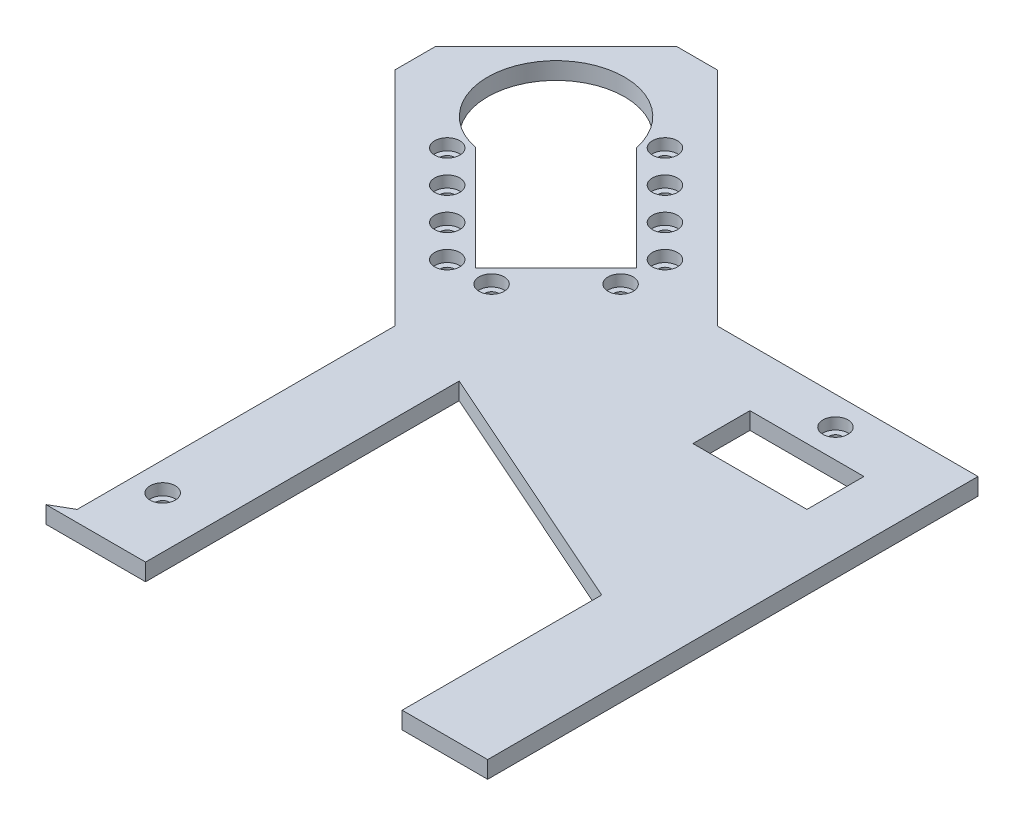
from build123d import *

# Parameters (mm, degrees)
EXTRUDE_1_DEPTH              = 3
CUT_EXTRUDE_1_REACH          = 217.134
HOLE_WIZARD_M2_2_D           = 2.4
HOLE_WIZARD_M2_2_CBORE_D     = 4.4
HOLE_WIZARD_M2_2_CBORE_DEPTH = 2
CUT_EXTRUDE_2_REACH          = 217.134
HOLE_WIZARD_M2_3_D           = 2.4
HOLE_WIZARD_M2_3_CBORE_D     = 4.4
HOLE_WIZARD_M2_3_CBORE_DEPTH = 2
MIRROR_7_COPY_1_REACH        = 217.134
MIRROR_7_COPY_2_D            = 2.4
MIRROR_7_COPY_2_CBORE_D      = 4.4
MIRROR_7_COPY_2_CBORE_DEPTH  = 2
CUT_EXTRUDE_3_REACH          = 217.134
SKETCH_18_W                  = 20
SKETCH_18_H                  = 10
HOLE_WIZARD_M2_4_D           = 2.4
HOLE_WIZARD_M2_4_CBORE_D     = 4.4
HOLE_WIZARD_M2_4_CBORE_DEPTH = 2
HOLE_WIZARD_M2_5_D           = 2.4
HOLE_WIZARD_M2_5_CBORE_D     = 4.4
HOLE_WIZARD_M2_5_CBORE_DEPTH = 2
HOLE_WIZARD_M2_6_D           = 2.4
HOLE_WIZARD_M2_6_CBORE_D     = 4.4
HOLE_WIZARD_M2_6_CBORE_DEPTH = 2
SKETCH_24_W                  = 20
SKETCH_24_H                  = 56
CUT_EXTRUDE_4_DEPTH          = 10
HOLE_WIZARD_M2_7_D           = 2.4
HOLE_WIZARD_M2_7_CBORE_D     = 4.4
HOLE_WIZARD_M2_7_CBORE_DEPTH = 2
SKETCH_26_OUTSIDE_W          = 390.69
SKETCH_26_OUTSIDE_H          = 393.83
SKETCH_26_OUTSIDE_W_2        = 112.890872965
SKETCH_26_OUTSIDE_H_2        = 124.890872965
CUT_EXTRUDE_5_DEPTH          = 10


with BuildPart() as part:
    # 草图1 → 凸台-拉伸1 (new body)
    with BuildSketch(Plane(origin=(0, 0, 0), x_dir=(1, 0, 0), z_dir=(0, 1, 0))):
        Polygon((-45.715728753, 114), (45.715728753, 114), (84.606601718, 152.890872965), (91.67766953, 152.890872965), (112.890872965, 131.67766953), (112.890872965, 124.606601718), (74, 85.715728753), (74, 30), (91.320508076, 20), (146.320508076, 20), (151.320508076, 15), (151.320508076, -15), (146.320508076, -20), (91.320508076, -20), (74, -30), (74, -85.715728753), (112.890872965, -124.606601718), (112.890872965, -131.67766953), (91.67766953, -152.890872965), (84.606601718, -152.890872965), (45.715728753, -114), (-45.715728753, -114), (-84.606601718, -152.890872965), (-91.67766953, -152.890872965), (-112.890872965, -131.67766953), (-112.890872965, -124.606601718), (-74, -85.715728753), (-74, -30), (-91.320508076, -20), (-146.320508076, -20), (-151.320508076, -15), (-151.320508076, 15), (-146.320508076, 20), (-91.320508076, 20), (-74, 30), (-74, 85.715728753), (-112.890872965, 124.606601718), (-112.890872965, 131.67766953), (-91.67766953, 152.890872965), (-84.606601718, 152.890872965), align=None)
    extrude(amount=EXTRUDE_1_DEPTH)

    # 草图2 → 切除-拉伸1 (cut, up to next)
    with BuildSketch(Plane(origin=(0, 3, 0), x_dir=(1, 0, 0), z_dir=(0, 1, 0)), mode=Mode.PRIVATE) as cut_extrude_1_sk1:
        with BuildLine():
            Line((103.820508076, -10), (103.820508076, 10))
            Line((103.820508076, 10), (129.687258495, 10))
            ThreePointArc((129.687258495, 10), (148.320508076, 0), (129.687258495, -10))
            Line((129.687258495, -10), (103.820508076, -10))
        make_face()
    cut_extrude_1_tool1 = extrude(cut_extrude_1_sk1.sketch, amount=-CUT_EXTRUDE_1_REACH, mode=Mode.PRIVATE) & part.part
    cut_extrude_1 = cut_extrude_1_tool1.solids().sort_by_distance((125.74589, 3, 0))[0]
    add(cut_extrude_1, mode=Mode.SUBTRACT)

    # M2 凹头盖螺钉的柱形沉头孔2 (through all)
    with Locations(Plane(origin=(100.320508076, 3, -8), x_dir=(0, 0, 1), z_dir=(0, 1, 0))):
        with Locations((0, 0), (-5.5, 5.25), (-5.5, 13.25), (-5.5, 21.25), (-5.5, 29.25), (16, 0), (21.5, 5.25), (21.5, 13.25), (21.5, 21.25), (21.5, 29.25)):
            hole_wizard_m2_2 = CounterBoreHole(HOLE_WIZARD_M2_2_D / 2, HOLE_WIZARD_M2_2_CBORE_D / 2, HOLE_WIZARD_M2_2_CBORE_DEPTH)

    # 草图10 → 切除-拉伸2 (cut, up to next)
    with BuildSketch(Plane(origin=(0, 3, 0), x_dir=(1, 0, 0), z_dir=(0, 1, 0)), mode=Mode.PRIVATE) as cut_extrude_2_sk1:
        with BuildLine():
            Line((75.767766953, 101.625631329), (61.625631329, 115.767766953))
            Line((61.625631329, 115.767766953), (79.916185958, 134.058321582))
            ThreePointArc((79.916185958, 134.058321582), (100.162950904, 140.162950904), (94.058321582, 119.916185958))
            Line((94.058321582, 119.916185958), (75.767766953, 101.625631329))
        make_face()
    cut_extrude_2_tool1 = extrude(cut_extrude_2_sk1.sketch, amount=-CUT_EXTRUDE_2_REACH, mode=Mode.PRIVATE) & part.part
    cut_extrude_2 = cut_extrude_2_tool1.solids().sort_by_distance((84.200285, 3, -124.200285))[0]
    add(cut_extrude_2, mode=Mode.SUBTRACT)

    # M2 凹头盖螺钉的柱形沉头孔3 (through all)
    with Locations(Plane(origin=(60.388194462, 3, -119.480077554), x_dir=(0, 0, 1), z_dir=(0, 1, 0))):
        with Locations((0, 0), (-5.65685425, 5.65685425), (-11.313708499, 11.313708499), (-16.970562749, 16.970562749), (7.601397898, 0.176776695), (18.915106397, 11.490485194), (19.091883092, 19.091883092), (13.435028842, 24.748737342), (7.778174593, 30.405591591), (2.121320343, 36.062445841)):
            hole_wizard_m2_3 = CounterBoreHole(HOLE_WIZARD_M2_3_D / 2, HOLE_WIZARD_M2_3_CBORE_D / 2, HOLE_WIZARD_M2_3_CBORE_DEPTH)

    # 镜向5: 切除-拉伸1, M2 凹头盖螺钉的柱形沉头孔2 across plane
    add(cut_extrude_1.mirror(Plane(origin=(0, 0, 0), x_dir=(0, 0, 1), z_dir=(1, 0, 0))), mode=Mode.SUBTRACT)
    add(hole_wizard_m2_2.mirror(Plane(origin=(0, 0, 0), x_dir=(0, 0, 1), z_dir=(1, 0, 0))), mode=Mode.SUBTRACT)

    # 镜向6: 切除-拉伸2, M2 凹头盖螺钉的柱形沉头孔3 across plane
    add(cut_extrude_2.mirror(Plane(origin=(0, 0, 0), x_dir=(0, 0, 1), z_dir=(1, 0, 0))), mode=Mode.SUBTRACT)
    add(hole_wizard_m2_3.mirror(Plane(origin=(0, 0, 0), x_dir=(0, 0, 1), z_dir=(1, 0, 0))), mode=Mode.SUBTRACT)

    # 镜向7: 切除-拉伸2, M2 凹头盖螺钉的柱形沉头孔3 across plane
    add(cut_extrude_2.mirror(Plane.XY), mode=Mode.SUBTRACT)
    add(hole_wizard_m2_3.mirror(Plane.XY), mode=Mode.SUBTRACT)

    # 镜向7 copy 1 sketch → 镜向7 copy 1 (cut, up to next)
    with BuildSketch(Plane(origin=(0, 3, 0), x_dir=(-1, 0, 0), z_dir=(0, 1, 0)), mode=Mode.PRIVATE) as mirror_7_copy_1_sk1:
        with BuildLine():
            Line((75.767766953, 101.625631329), (61.625631329, 115.767766953))
            Line((61.625631329, 115.767766953), (79.916185958, 134.058321582))
            ThreePointArc((79.916185958, 134.058321582), (100.162950904, 140.162950904), (94.058321582, 119.916185958))
            Line((94.058321582, 119.916185958), (75.767766953, 101.625631329))
        make_face()
    mirror_7_copy_1_tool1 = extrude(mirror_7_copy_1_sk1.sketch, amount=-MIRROR_7_COPY_1_REACH, mode=Mode.PRIVATE) & part.part
    add(mirror_7_copy_1_tool1.solids().sort_by_distance((-84.200285, 3, 124.200285))[0], mode=Mode.SUBTRACT)

    # 镜向7 copy 2 (through all)
    with Locations(Plane(origin=(-60.388194462, 3, 119.480077554), x_dir=(0, 0, -1), z_dir=(0, 1, 0))):
        with Locations((0, 0), (-5.65685425, 5.65685425), (-11.313708499, 11.313708499), (-16.970562749, 16.970562749), (7.601397898, 0.176776695), (18.915106397, 11.490485194), (19.091883092, 19.091883092), (13.435028842, 24.748737342), (7.778174593, 30.405591591), (2.121320343, 36.062445841)):
            CounterBoreHole(MIRROR_7_COPY_2_D / 2, MIRROR_7_COPY_2_CBORE_D / 2, MIRROR_7_COPY_2_CBORE_DEPTH)

    # 草图18 → 切除-拉伸3 (cut, up to next)
    with BuildSketch(Plane(origin=(0, 3, 0), x_dir=(1, 0, 0), z_dir=(0, 1, 0)), mode=Mode.PRIVATE) as cut_extrude_3_sk1:
        Polygon((-60, -28), (-15, -28), (-15, -63), (-60, -83), align=None)
    cut_extrude_3_tool1 = extrude(cut_extrude_3_sk1.sketch, amount=-CUT_EXTRUDE_3_REACH, mode=Mode.PRIVATE) & part.part
    # 草图18 → 切除-拉伸3 (cut, up to next)
    with BuildSketch(Plane(origin=(0, 3, 0), x_dir=(1, 0, 0), z_dir=(0, 1, 0)), mode=Mode.PRIVATE) as cut_extrude_3_sk2:
        with Locations((20, -99)):
            Rectangle(SKETCH_18_W, SKETCH_18_H)
    cut_extrude_3_tool2 = extrude(cut_extrude_3_sk2.sketch, amount=-CUT_EXTRUDE_3_REACH, mode=Mode.PRIVATE) & part.part
    # 草图18 → 切除-拉伸3 (cut, up to next)
    with BuildSketch(Plane(origin=(0, 3, 0), x_dir=(1, 0, 0), z_dir=(0, 1, 0)), mode=Mode.PRIVATE) as cut_extrude_3_sk3:
        with Locations((-20, -99)):
            Rectangle(SKETCH_18_W, SKETCH_18_H)
    cut_extrude_3_tool3 = extrude(cut_extrude_3_sk3.sketch, amount=-CUT_EXTRUDE_3_REACH, mode=Mode.PRIVATE) & part.part
    # 草图18 → 切除-拉伸3 (cut, up to next)
    with BuildSketch(Plane(origin=(0, 3, 0), x_dir=(1, 0, 0), z_dir=(0, 1, 0)), mode=Mode.PRIVATE) as cut_extrude_3_sk4:
        Polygon((15, -63), (60, -83), (60, -28), (15, -28), align=None)
    cut_extrude_3_tool4 = extrude(cut_extrude_3_sk4.sketch, amount=-CUT_EXTRUDE_3_REACH, mode=Mode.PRIVATE) & part.part
    # 草图18 → 切除-拉伸3 (cut, up to next)
    with BuildSketch(Plane(origin=(0, 3, 0), x_dir=(1, 0, 0), z_dir=(0, 1, 0)), mode=Mode.PRIVATE) as cut_extrude_3_sk5:
        with Locations((-20, 99)):
            Rectangle(SKETCH_18_W, SKETCH_18_H)
    cut_extrude_3_tool5 = extrude(cut_extrude_3_sk5.sketch, amount=-CUT_EXTRUDE_3_REACH, mode=Mode.PRIVATE) & part.part
    # 草图18 → 切除-拉伸3 (cut, up to next)
    with BuildSketch(Plane(origin=(0, 3, 0), x_dir=(1, 0, 0), z_dir=(0, 1, 0)), mode=Mode.PRIVATE) as cut_extrude_3_sk6:
        with Locations((20, 99)):
            Rectangle(SKETCH_18_W, SKETCH_18_H)
    cut_extrude_3_tool6 = extrude(cut_extrude_3_sk6.sketch, amount=-CUT_EXTRUDE_3_REACH, mode=Mode.PRIVATE) & part.part
    # 草图18 → 切除-拉伸3 (cut, up to next)
    with BuildSketch(Plane(origin=(0, 3, 0), x_dir=(1, 0, 0), z_dir=(0, 1, 0)), mode=Mode.PRIVATE) as cut_extrude_3_sk7:
        Polygon((15, 63), (60, 83), (60, 28), (15, 28), align=None)
    cut_extrude_3_tool7 = extrude(cut_extrude_3_sk7.sketch, amount=-CUT_EXTRUDE_3_REACH, mode=Mode.PRIVATE) & part.part
    # 草图18 → 切除-拉伸3 (cut, up to next)
    with BuildSketch(Plane(origin=(0, 3, 0), x_dir=(1, 0, 0), z_dir=(0, 1, 0)), mode=Mode.PRIVATE) as cut_extrude_3_sk8:
        Polygon((-15, 28), (-15, 63), (-60, 83), (-60, 28), align=None)
    cut_extrude_3_tool8 = extrude(cut_extrude_3_sk8.sketch, amount=-CUT_EXTRUDE_3_REACH, mode=Mode.PRIVATE) & part.part
    add(cut_extrude_3_tool1.solids().sort_by_distance((-39.166667, 3, 50.87037))[0], mode=Mode.SUBTRACT)
    add(cut_extrude_3_tool2.solids().sort_by_distance((20, 3, 99))[0], mode=Mode.SUBTRACT)
    add(cut_extrude_3_tool3.solids().sort_by_distance((-20, 3, 99))[0], mode=Mode.SUBTRACT)
    add(cut_extrude_3_tool4.solids().sort_by_distance((39.166667, 3, 50.87037))[0], mode=Mode.SUBTRACT)
    add(cut_extrude_3_tool5.solids().sort_by_distance((-20, 3, -99))[0], mode=Mode.SUBTRACT)
    add(cut_extrude_3_tool6.solids().sort_by_distance((20, 3, -99))[0], mode=Mode.SUBTRACT)
    add(cut_extrude_3_tool7.solids().sort_by_distance((39.166667, 3, -50.87037))[0], mode=Mode.SUBTRACT)
    add(cut_extrude_3_tool8.solids().sort_by_distance((-39.166667, 3, -50.87037))[0], mode=Mode.SUBTRACT)

    # M2 凹头盖螺钉的柱形沉头孔4 (through all)
    with Locations(Plane(origin=(-20, 3, 109), x_dir=(0, 0, 1), z_dir=(0, 1, 0))):
        with Locations((0, 0), (0, 40), (-218, 0), (-218, 40)):
            CounterBoreHole(HOLE_WIZARD_M2_4_D / 2, HOLE_WIZARD_M2_4_CBORE_D / 2, HOLE_WIZARD_M2_4_CBORE_DEPTH)

    # M2 凹头盖螺钉的柱形沉头孔5 (through all)
    with Locations(Plane(origin=(-69, 3, -40), x_dir=(0, 0, 1), z_dir=(0, 1, 0))):
        with Locations((0, 0), (0, 138)):
            hole_wizard_m2_5 = CounterBoreHole(HOLE_WIZARD_M2_5_D / 2, HOLE_WIZARD_M2_5_CBORE_D / 2, HOLE_WIZARD_M2_5_CBORE_DEPTH)

    # 镜向8: M2 凹头盖螺钉的柱形沉头孔5 across plane
    add(hole_wizard_m2_5.mirror(Plane.XY), mode=Mode.SUBTRACT)

    # M2 凹头盖螺钉的柱形沉头孔6 (through all)
    with Locations(Plane(origin=(-69, 3, 0), x_dir=(0, 0, 1), z_dir=(0, 1, 0))):
        with Locations((0, 0), (0, 138)):
            CounterBoreHole(HOLE_WIZARD_M2_6_D / 2, HOLE_WIZARD_M2_6_CBORE_D / 2, HOLE_WIZARD_M2_6_CBORE_DEPTH)

    # 草图24 → 切除-拉伸4 (cut)
    with BuildSketch(Plane(origin=(0, 3, 0), x_dir=(1, 0, 0), z_dir=(0, 1, 0))):
        Rectangle(SKETCH_24_W, SKETCH_24_H)
    extrude(amount=-CUT_EXTRUDE_4_DEPTH, mode=Mode.SUBTRACT)

    # M2 凹头盖螺钉的柱形沉头孔7 (through all)
    with Locations(Plane(origin=(-20, 3, 0), x_dir=(0, 0, 1), z_dir=(0, 1, 0))):
        with Locations((0, 0), (0, 40)):
            CounterBoreHole(HOLE_WIZARD_M2_7_D / 2, HOLE_WIZARD_M2_7_CBORE_D / 2, HOLE_WIZARD_M2_7_CBORE_DEPTH)

    # 草图26 outside → 切除-拉伸5 (cut)
    with BuildSketch(Plane(origin=(0, 3, 0), x_dir=(1, 0, 0), z_dir=(0, 1, 0))):
        Rectangle(SKETCH_26_OUTSIDE_W, SKETCH_26_OUTSIDE_H)
        with Locations((-56.445436483, 90.445436482)):
            Rectangle(SKETCH_26_OUTSIDE_W_2, SKETCH_26_OUTSIDE_H_2, mode=Mode.SUBTRACT)
    extrude(amount=-CUT_EXTRUDE_5_DEPTH, mode=Mode.SUBTRACT)


solid = part.part
